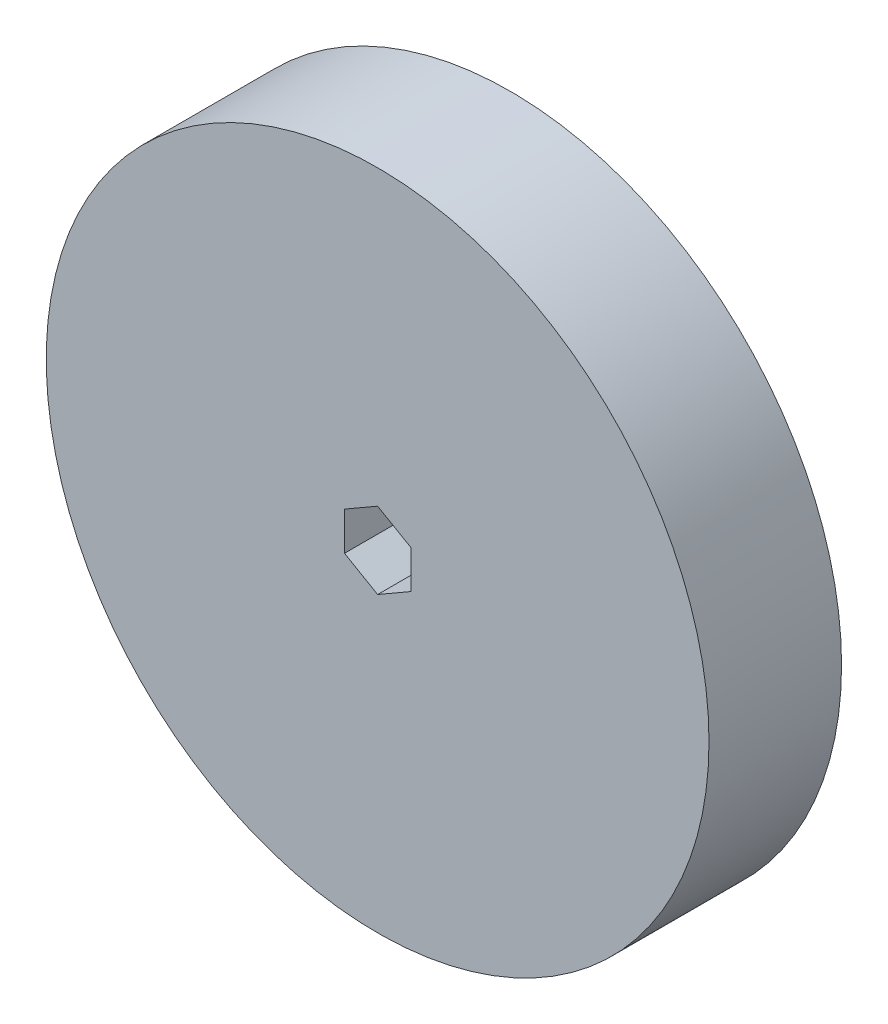
from build123d import *

# Parameters (mm, degrees)
SKETCH1_R           = 63.5
BOSS_EXTRUDE1_DEPTH = 25.4


with BuildPart() as part:
    # Sketch1 → Boss-Extrude1 (new body)
    with BuildSketch(Plane.XY):
        Circle(SKETCH1_R)
        Polygon((0, 7.332348419), (-6.35, 3.666174209), (-6.35, -3.666174209), (0, -7.332348419), (6.35, -3.666174209), (6.35, 3.666174209), align=None, mode=Mode.SUBTRACT)
    extrude(amount=BOSS_EXTRUDE1_DEPTH)


solid = part.part
